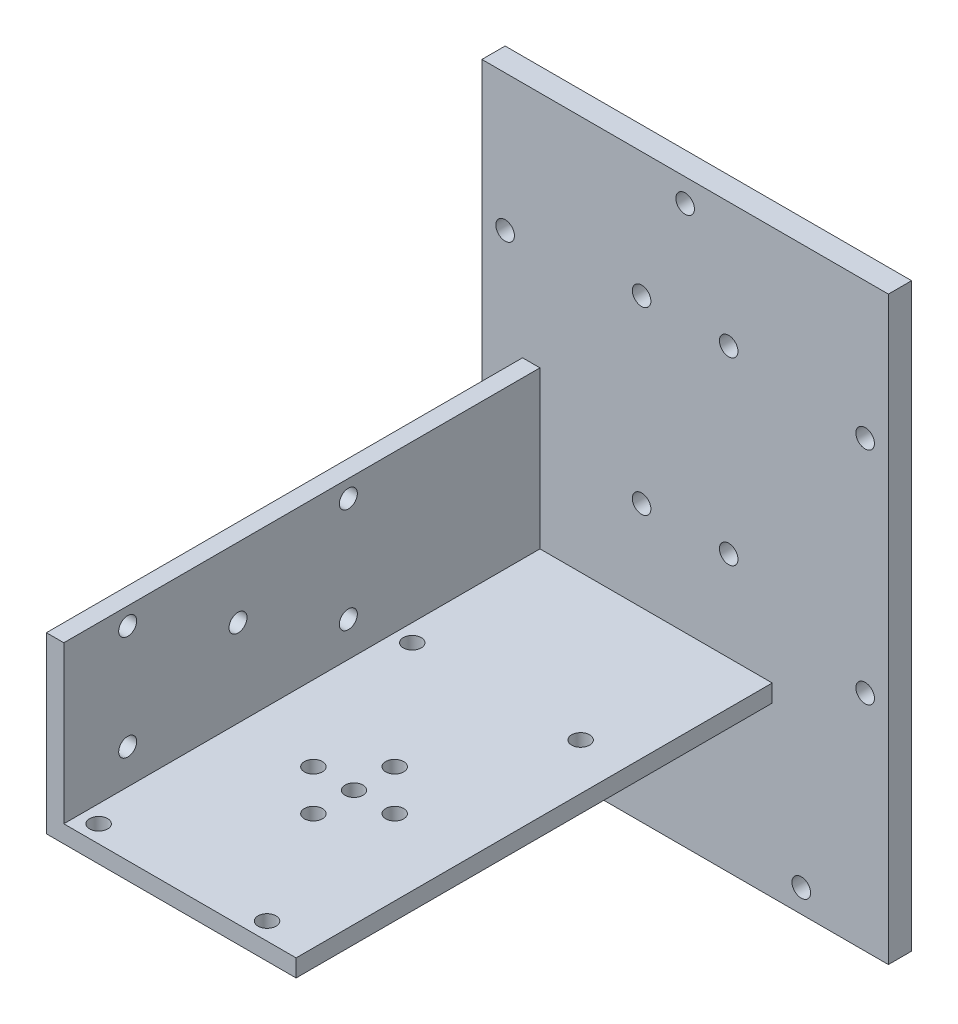
from build123d import *

# Parameters (mm, degrees)
SKETCH_1_W          = 70
SKETCH_1_H          = 100
SKETCH_1_R          = 1.6
EXTRUDE_1_DEPTH     = 4
SKETCH_2_W          = 25
SKETCH_2_H          = 3
SKETCH_2_W_2        = 15
EXTRUDE_2_DEPTH     = 82
SKETCH_3_R          = 1.55
SKETCH_3_R_2        = 1.539226355
CUT_EXTRUDE_1_DEPTH = 8
EXTRUDE_3_DEPTH     = 2
SKETCH_7_R          = 1.6
EXTRUDE_5_DEPTH     = 82
SKETCH_10_R         = 1.55
CUT_EXTRUDE_2_DEPTH = 118.749734607


with BuildPart() as part:
    # 草图1 → 凸台-拉伸1 (new body)
    with BuildSketch(Plane.XY):
        with Locations((3.334002404, 0)):
            Rectangle(SKETCH_1_W, SKETCH_1_H)
        with Locations((34.334002404, 26.5)):
            Circle(SKETCH_1_R, mode=Mode.SUBTRACT)
        with Locations((-16.665997596, -46)):
            Circle(SKETCH_1_R, mode=Mode.SUBTRACT)
        with Locations((3.334002404, 46)):
            Circle(SKETCH_1_R, mode=Mode.SUBTRACT)
        with Locations((10.834002404, 28.5)):
            Circle(SKETCH_1_R, mode=Mode.SUBTRACT)
        with Locations((10.834002404, -2.5)):
            Circle(SKETCH_1_R, mode=Mode.SUBTRACT)
        with Locations((34.334002404, -11.5)):
            Circle(SKETCH_1_R, mode=Mode.SUBTRACT)
        with Locations(Location((-27.665997596, 26.5, 0), (0, 0, 180))):
            Circle(SKETCH_1_R, mode=Mode.SUBTRACT)
        with Locations(Location((-4.165997596, 28.5, 0), (0, 0, 180))):
            Circle(SKETCH_1_R, mode=Mode.SUBTRACT)
        with Locations(Location((-4.165997596, -2.5, 0), (0, 0, 180))):
            Circle(SKETCH_1_R, mode=Mode.SUBTRACT)
        with Locations(Location((-27.665997596, -11.5, 0), (0, 0, 180))):
            Circle(SKETCH_1_R, mode=Mode.SUBTRACT)
        with Locations(Location((23.334002404, -46, 0), (0, 0, 180))):
            Circle(SKETCH_1_R, mode=Mode.SUBTRACT)
    extrude(amount=EXTRUDE_1_DEPTH)

    # 草图2 → 凸台-拉伸2 (add)
    with BuildSketch(Plane.XY.offset(4)):
        with Locations((-9.165997596, -19.5)):
            Rectangle(SKETCH_2_W, SKETCH_2_H)
        with Locations((10.834002404, -19.5)):
            Rectangle(SKETCH_2_W_2, SKETCH_2_H)
    extrude(amount=EXTRUDE_2_DEPTH)

    # 草图3 → 切除-拉伸1 (cut)
    with BuildSketch(Plane.XZ.offset(21)):
        with Locations(Location((-18.665997596, 83, 0), (0, 0, 270))):
            Circle(SKETCH_3_R)
        with Locations(Location((10.334002404, 83, 0), (0, 0, 270))):
            Circle(SKETCH_3_R)
        with Locations(Location((-1.685541592, 63, 0), (0, 0, 270))):
            Circle(SKETCH_3_R)
        with Locations(Location((-1.685541592, 56, 0), (0, 0, 270))):
            Circle(SKETCH_3_R_2)
        with Locations(Location((-8.685541592, 56, 0), (0, 0, 270))):
            Circle(SKETCH_3_R)
        with Locations(Location((-1.685541592, 49, 0), (0, 0, 270))):
            Circle(SKETCH_3_R)
        with Locations(Location((5.314458408, 56, 0), (0, 0, 270))):
            Circle(SKETCH_3_R)
        with Locations(Location((-18.665997596, 29, 0), (0, 0, 270))):
            Circle(SKETCH_3_R)
        with Locations(Location((10.334002404, 29, 0), (0, 0, 270))):
            Circle(SKETCH_3_R)
    extrude(amount=-CUT_EXTRUDE_1_DEPTH, mode=Mode.SUBTRACT)

    # 草图6 → 凸台-拉伸3 (add, symmetric)
    with BuildSketch(Plane.YZ.offset(-1.665997596)):
        Polygon((-21, 44.617390455), (-21, 4), (-35.87334108, 4), align=None)
    extrude(amount=EXTRUDE_3_DEPTH, both=True)

    # 草图7 → 凸台-拉伸5 (add)
    with BuildSketch(Plane.XY.offset(4)):
        with Locations(Location((-27.665997596, -11.5, 0), (0, 0, 180))):
            Circle(SKETCH_7_R)
        Polygon((-24.665997596, 9), (-24.665997596, -21), (-21.665997596, -21), (-21.665997596, -18), (-21.665997596, 9), align=None)
    extrude(amount=EXTRUDE_5_DEPTH)


with BuildPart() as extrude_5_kept_piece:
    # of the separate pieces the step leaves, the one the design keeps (extrude_5_pieces_kept)
    add(part.part.solids().sort_by_distance((-31.665997596, 50, 0))[0])

    # 草图10 → 切除-拉伸2 (cut, through all)
    with BuildSketch(Plane(origin=(-24.665997596, 0, 0), x_dir=(0, 0, -1), z_dir=(1, 0, 0))):
        with Locations(Location((-75, 6, 0), (0, 0, 270))):
            Circle(SKETCH_10_R)
        with Locations(Location((-75, -12, 0), (0, 0, 180))):
            Circle(SKETCH_10_R)
        with Locations(Location((-56, -3, 0), (0, 0, 180))):
            Circle(SKETCH_10_R)
        with Locations(Location((-37, 6, 0), (0, 0, 180))):
            Circle(SKETCH_10_R)
        with Locations(Location((-37, -12, 0), (0, 0, 270))):
            Circle(SKETCH_10_R)
    extrude(amount=CUT_EXTRUDE_2_DEPTH, mode=Mode.SUBTRACT)


solid = extrude_5_kept_piece.part
